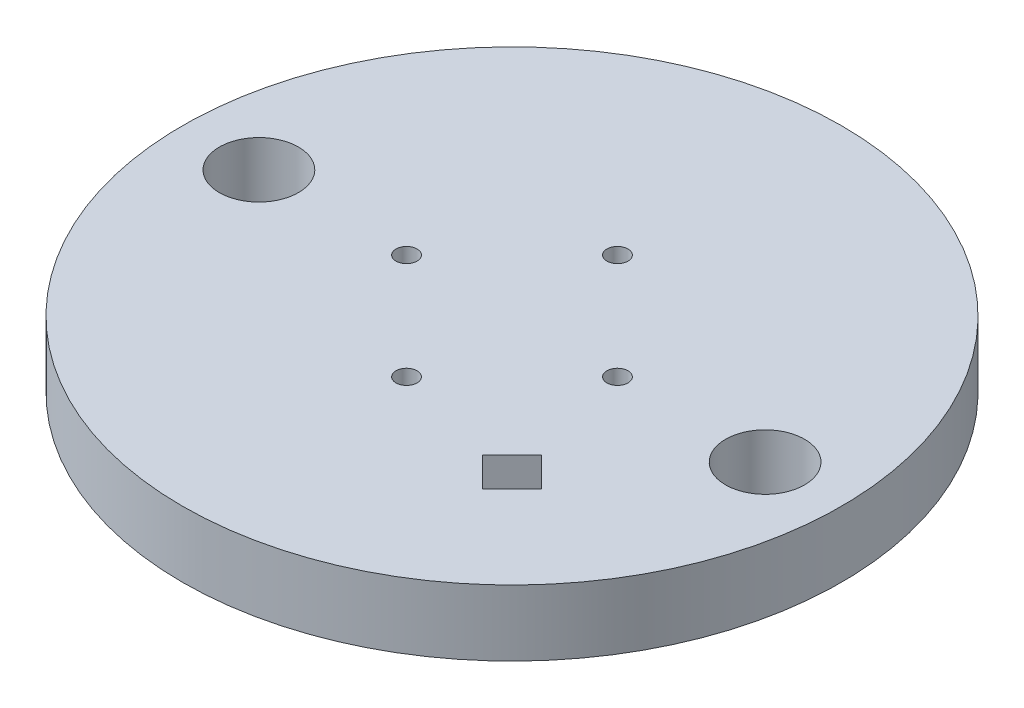
from build123d import *

# Parameters (mm, degrees)
SKETCH1_R           = 7.9375
SKETCH1_R_2         = 0.9525
SKETCH1_R_3         = 0.254
BOSS_EXTRUDE1_DEPTH = 1.5875


with BuildPart() as part:
    # Sketch1 → Boss-Extrude1 (new body)
    with BuildSketch(Plane(origin=(0, 0, 0), x_dir=(1, 0, 0), z_dir=(0, 1, 0))):
        with Locations(Location((0, 0, 0), (0, 0, 270))):
            Circle(SKETCH1_R)
        with Locations(Location((-6.096, 0, 0), (0, 0, 270))):
            Circle(SKETCH1_R_2, mode=Mode.SUBTRACT)
        with Locations(Location((6.096, 0, 0), (0, 0, 270))):
            Circle(SKETCH1_R_2, mode=Mode.SUBTRACT)
        with Locations(Location((0, 2.54, 0), (0, 0, 270))):
            Circle(SKETCH1_R_3, mode=Mode.SUBTRACT)
        with Locations(Location((-2.54, 0, 0), (0, 0, 270))):
            Circle(SKETCH1_R_3, mode=Mode.SUBTRACT)
        with Locations(Location((0, -2.54, 0), (0, 0, 270))):
            Circle(SKETCH1_R_3, mode=Mode.SUBTRACT)
        with Locations(Location((2.54, 0, 0), (0, 0, 270))):
            Circle(SKETCH1_R_3, mode=Mode.SUBTRACT)
        Polygon((3.252691193, -2.545584412), (3.959797975, -3.252691193), (3.252691193, -3.959797975), (2.545584412, -3.252691193), align=None, mode=Mode.SUBTRACT)
    extrude(amount=BOSS_EXTRUDE1_DEPTH)


solid = part.part
